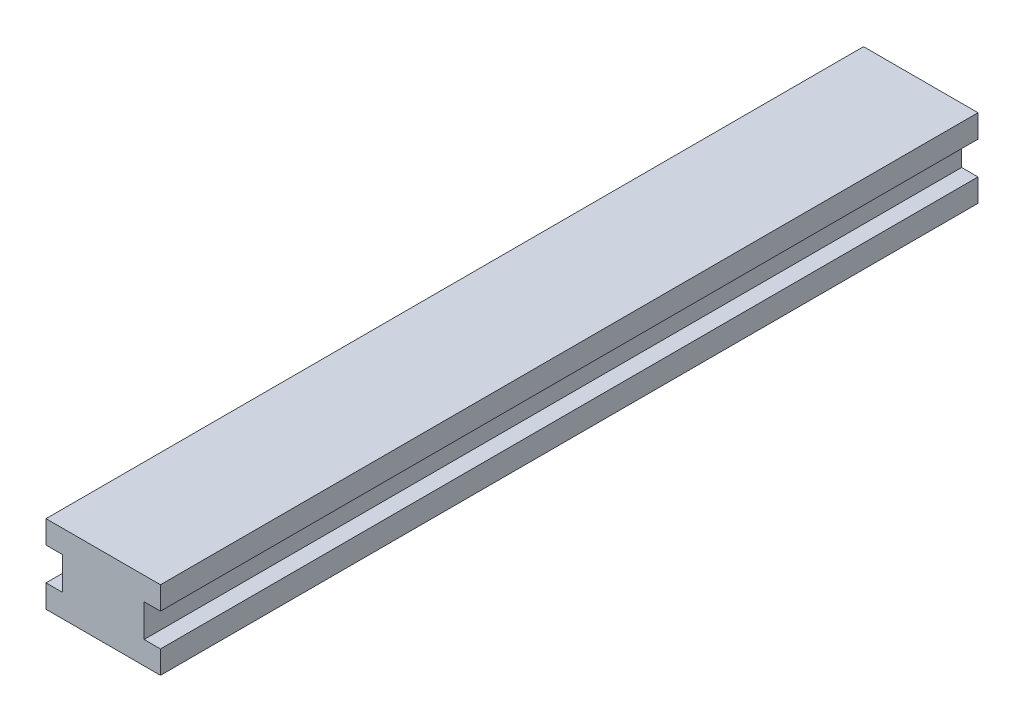
from build123d import *

# Parameters (mm, degrees)
BOSS_EXTRUDE1_DEPTH = 50


with BuildPart() as part:
    # Sketch1 → Boss-Extrude1 (new body)
    with BuildSketch(Plane.XY):
        Polygon((-3.5, -1), (-3.5, -2.4), (3.5, -2.4), (3.5, -1), (2.5, -1), (2.5, 1), (3.5, 1), (3.5, 2.4), (-3.5, 2.4), (-3.5, 1), (-2.5, 1), (-2.5, -1), align=None)
    extrude(amount=BOSS_EXTRUDE1_DEPTH)


solid = part.part
